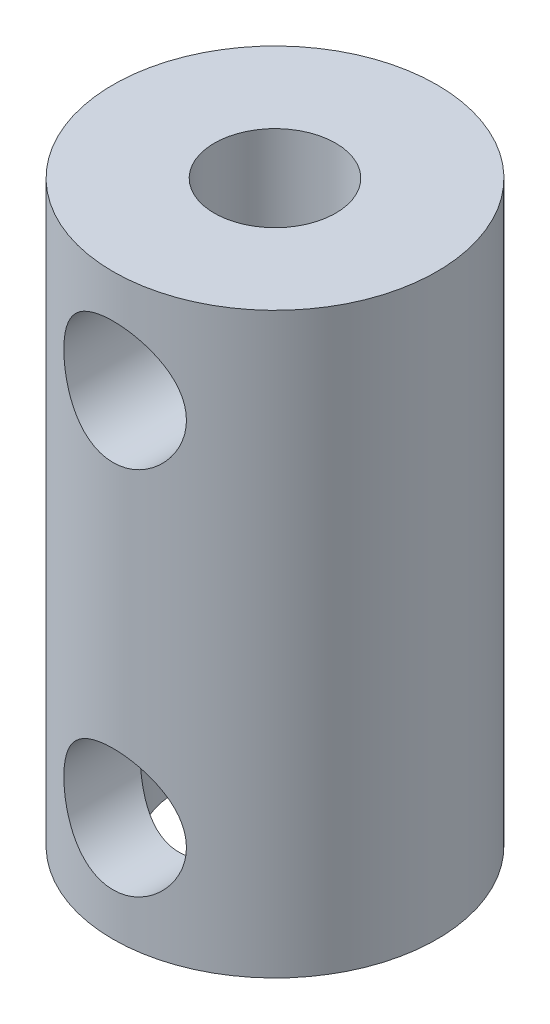
from build123d import *

# Parameters (mm, degrees)
SKETCH1_W                        = 5.334
SKETCH1_H                        = 19.05
F_21_0_159_DIAMETER_HOLE1_D      = 4.0386
F_21_0_159_DIAMETER_HOLE1_DEPTH  = 5.334
F_21_0_159_DIAMETER_HOLE2_REACH  = 21.654
F_21_0_159_DIAMETER_HOLE2_BORE_R = 2.0193


with BuildPart() as part:
    # Sketch1 → Revolve1 (revolve)
    with BuildSketch(Plane.XY, mode=Mode.PRIVATE) as revolve1_sk:
        with Locations((2.667, 9.525)):
            Rectangle(SKETCH1_W, SKETCH1_H)
    revolve(revolve1_sk.sketch.rotate(Axis((0, 19.05, 0), (0, -1, 0)), 270), axis=Axis((0, 19.05, 0), (0, -1, 0)))

    # Sketch2 → CSK for #6 Flat Head Machine Screw (100)1 (revolve, cut)
    with BuildSketch(Plane(origin=(0, 0, 0), x_dir=(0, 0, -1), z_dir=(1, 0, 0))):
        Polygon((0, 0), (0, 19.05), (2, 19.05), (2, 10.231011227), (3.175, 9.525), (3.175, 0), align=None)
    revolve(axis=Axis((0, -6.35, 0), (0, 1, 0)), mode=Mode.SUBTRACT)

    # #21 (0.159) Diameter Hole1
    with Locations(Plane(origin=(0, 15.621, 5.334), x_dir=(1, 0, 0), z_dir=(0, 0, 1))):
        with Locations((0, 0)):
            Hole(F_21_0_159_DIAMETER_HOLE1_D / 2, depth=F_21_0_159_DIAMETER_HOLE1_DEPTH)

    # #21 (0.159) Diameter Hole2 bore (on position points) → #21 (0.159) Diameter Hole2 (cut, up to next)
    with BuildSketch(Plane(origin=(0, 3.429, 5.334), x_dir=(1, 0, 0), z_dir=(0, 0, 1)), mode=Mode.PRIVATE) as f_21_0_159_diameter_hole2_sk1:
        Circle(F_21_0_159_DIAMETER_HOLE2_BORE_R)
    f_21_0_159_diameter_hole2_tool1 = extrude(f_21_0_159_diameter_hole2_sk1.sketch, amount=-F_21_0_159_DIAMETER_HOLE2_REACH, mode=Mode.PRIVATE) & part.part
    add(f_21_0_159_diameter_hole2_tool1.solids().sort_by_distance((0, 3.429, 5.334))[0], mode=Mode.SUBTRACT)


solid = part.part
